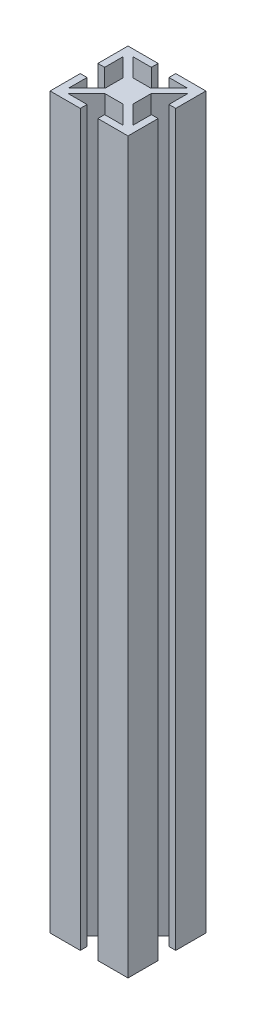
from build123d import *

# Parameters (mm, degrees)
BOSS_EXTRUDE1_DEPTH = 237.855125


with BuildPart() as part:
    # Sketch1 → Boss-Extrude1 (new body)
    with BuildSketch(Plane(origin=(11.365010382, 0, 9.846206226), x_dir=(1, 0, 0), z_dir=(0, 1, 0))):
        Polygon((-24.065010382, 22.546206226), (-14.229795365, 22.546206226), (-14.229795365, 20.336406226), (-20.292645817, 20.336406226), (-14.310945817, 14.354706226), (-8.419074947, 14.354706226), (-2.437374947, 20.336406226), (-8.5002254, 20.336406226), (-8.5002254, 22.546206226), (1.334989618, 22.546206226), (1.334989618, 12.710991208), (-0.874810382, 12.710991208), (-0.874810382, 18.773841661), (-6.856510382, 12.792141661), (-6.856510382, 6.900270791), (-0.874810382, 0.918570791), (-0.874810382, 6.981421243), (1.334989618, 6.981421243), (1.334989618, -2.853793774), (-8.5002254, -2.853793774), (-8.5002254, -0.643993774), (-2.437374947, -0.643993774), (-8.419074947, 5.337706226), (-14.310945817, 5.337706226), (-20.292645817, -0.643993774), (-14.229795365, -0.643993774), (-14.229795365, -2.853793774), (-24.065010382, -2.853793774), (-24.065010382, 6.981421243), (-21.855210382, 6.981421243), (-21.855210382, 0.918570791), (-15.873510382, 6.900270791), (-15.873510382, 12.792141661), (-21.855210382, 18.773841661), (-21.855210382, 12.710991208), (-24.065010382, 12.710991208), align=None)
    extrude(amount=BOSS_EXTRUDE1_DEPTH)


solid = part.part
